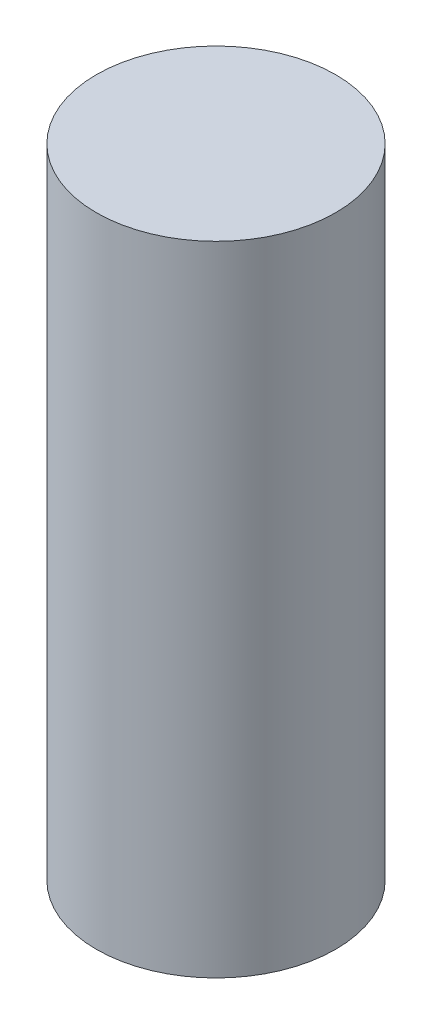
from build123d import *

# Parameters (mm, degrees)
SKETCH1_R           = 2.25
BOSS_EXTRUDE1_DEPTH = 12
SCALE1_SCALE        = 0.8


with BuildPart() as part:
    # Sketch1 → Boss-Extrude1 (new body)
    with BuildSketch(Plane(origin=(0, 0, 0), x_dir=(1, 0, 0), z_dir=(0, 1, 0))):
        with Locations(Location((0, 0, 0), (0, 0, 270))):
            Circle(SKETCH1_R)
    extrude(amount=BOSS_EXTRUDE1_DEPTH)


with BuildPart() as part_1:
    # Scale1: scaled about (0, 6, 0)
    add(part.part.scale(SCALE1_SCALE).moved(Location((0, 1.2, 0))))


solid = part_1.part
